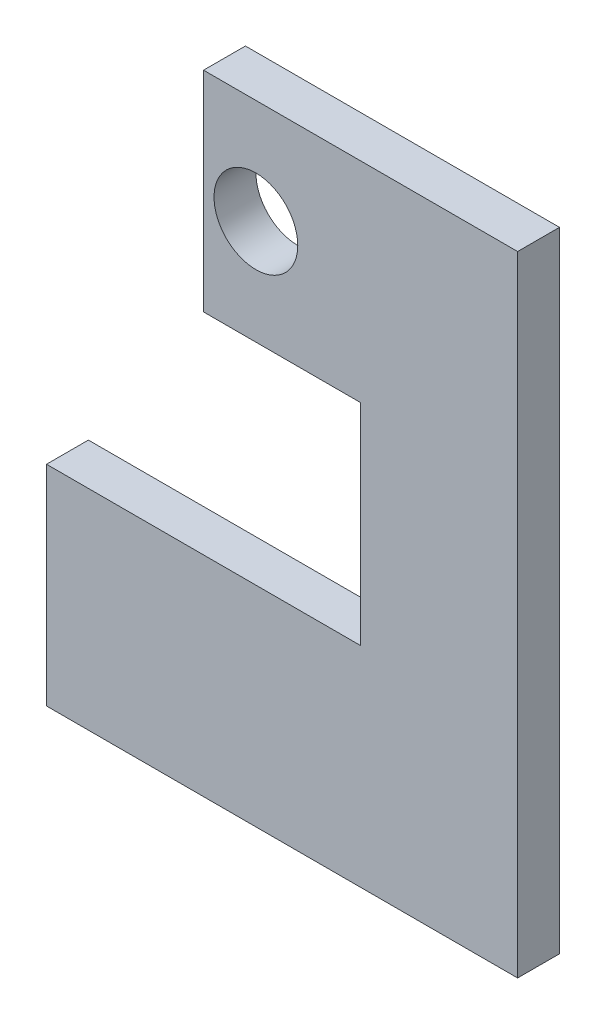
from build123d import *

# Parameters (mm, degrees)
SKETCH1_R           = 20
BOSS_EXTRUDE2_DEPTH = 20


with BuildPart() as part:
    # Sketch1 → Boss-Extrude2 (new body)
    with BuildSketch(Plane.XY):
        Polygon((-75, 50), (75, 50), (75, -50.738237202), (75, -250.488405268), (-150, -250.488405268), (-150, -150.488405268), (0, -150.488405268), (0, -50), (-75, -50), align=None)
        with Locations((-50, 0)):
            Circle(SKETCH1_R, mode=Mode.SUBTRACT)
    extrude(amount=BOSS_EXTRUDE2_DEPTH)


solid = part.part
